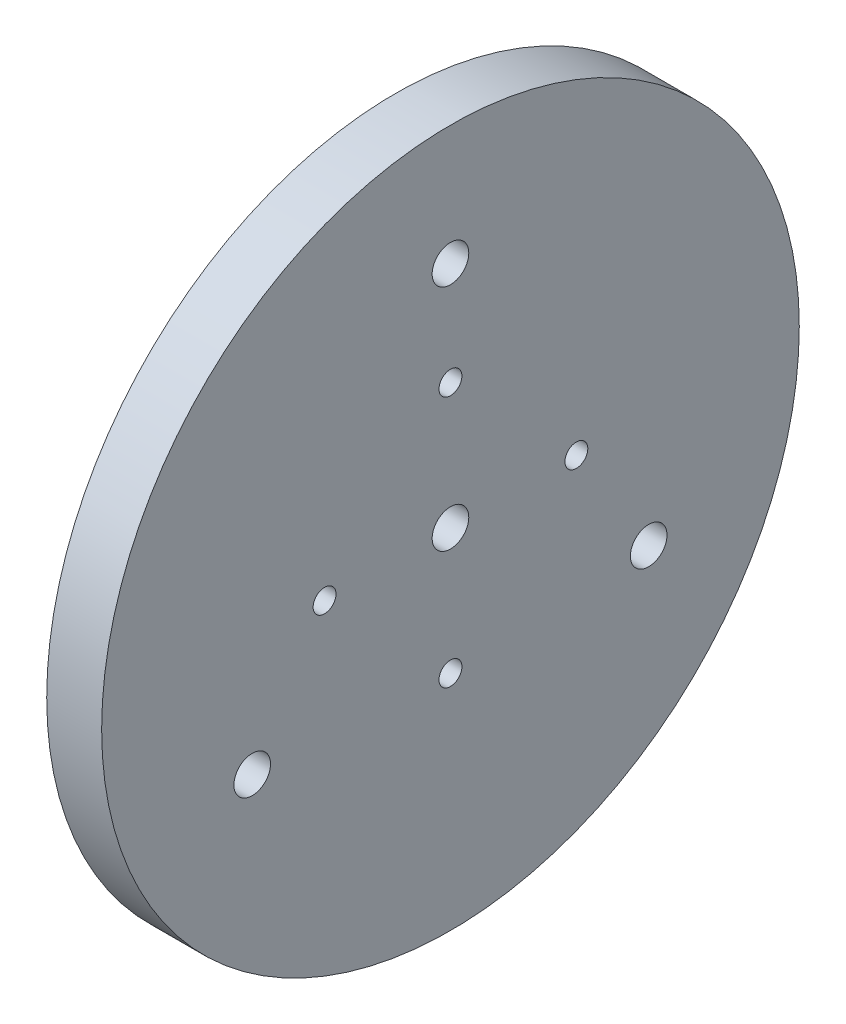
from build123d import *

# Parameters (mm, degrees)
SKETCH2_R           = 76.2
SKETCH2_R_2         = 2.5
SKETCH2_R_3         = 4
BOSS_EXTRUDE1_DEPTH = 12


with BuildPart() as part:
    # Sketch2 → Boss-Extrude1 (new body)
    with BuildSketch(Plane(origin=(0, 0, 0), x_dir=(0, 0, -1), z_dir=(1, 0, 0))):
        Circle(SKETCH2_R)
        with Locations((0, 27.5)):
            Circle(SKETCH2_R_2, mode=Mode.SUBTRACT)
        with Locations((27.5, 0)):
            Circle(SKETCH2_R_2, mode=Mode.SUBTRACT)
        with Locations((0, -27.5)):
            Circle(SKETCH2_R_2, mode=Mode.SUBTRACT)
        with Locations((-27.5, 0)):
            Circle(SKETCH2_R_2, mode=Mode.SUBTRACT)
        with Locations((0, 50)):
            Circle(SKETCH2_R_3, mode=Mode.SUBTRACT)
        with Locations((43.301270189, -25)):
            Circle(SKETCH2_R_3, mode=Mode.SUBTRACT)
        with Locations((-43.301270189, -25)):
            Circle(SKETCH2_R_3, mode=Mode.SUBTRACT)
        Circle(SKETCH2_R_3, mode=Mode.SUBTRACT)
    extrude(amount=BOSS_EXTRUDE1_DEPTH)


solid = part.part
